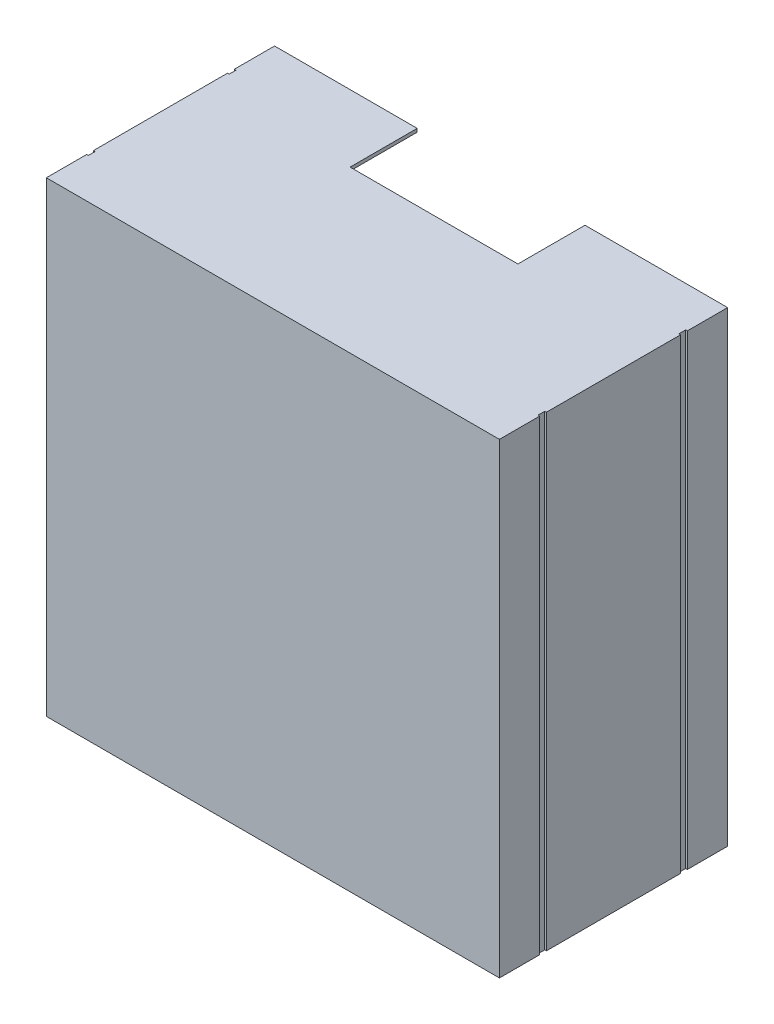
from build123d import *

# Parameters (mm, degrees)
SKETCH_1_W          = 270
SKETCH_1_H          = 136
EXTRUDE_1_DEPTH     = 278
SKETCH_2_W          = 266
SKETCH_2_H          = 274
CUT_EXTRUDE_1_DEPTH = 134
CUT_EXTRUDE_2_REACH = 318.438
SKETCH_3_W          = 100
SKETCH_3_H          = 40
CUT_EXTRUDE_3_REACH = 318.438
SKETCH_4_W          = 1
SKETCH_4_H          = 4


with BuildPart() as part:
    # 草图1 → 凸台-拉伸1 (new body)
    with BuildSketch(Plane(origin=(0, 0, 0), x_dir=(1, 0, 0), z_dir=(0, 1, 0))):
        Rectangle(SKETCH_1_W, SKETCH_1_H)
    extrude(amount=EXTRUDE_1_DEPTH)

    # 草图2 → 切除-拉伸1 (cut)
    with BuildSketch(Plane(origin=(0, 0, -68), x_dir=(-1, 0, 0), z_dir=(0, 0, -1))):
        with Locations((0, 139)):
            Rectangle(SKETCH_2_W, SKETCH_2_H)
    extrude(amount=-CUT_EXTRUDE_1_DEPTH, mode=Mode.SUBTRACT)

    # 草图3 → 切除-拉伸2 (cut, up to next)
    with BuildSketch(Plane(origin=(0, 278, 0), x_dir=(1, 0, 0), z_dir=(0, 1, 0)), mode=Mode.PRIVATE) as cut_extrude_2_sk1:
        with Locations((0, 48)):
            Rectangle(SKETCH_3_W, SKETCH_3_H)
    cut_extrude_2_tool1 = extrude(cut_extrude_2_sk1.sketch, amount=-CUT_EXTRUDE_2_REACH, mode=Mode.PRIVATE) & part.part
    add(cut_extrude_2_tool1.solids().sort_by_distance((0, 278, -48))[0], mode=Mode.SUBTRACT)

    # 草图4 → 切除-拉伸3 (cut, up to next)
    with BuildSketch(Plane.XZ, mode=Mode.PRIVATE) as cut_extrude_3_sk1:
        with Locations((-134.5, 42)):
            Rectangle(SKETCH_4_W, SKETCH_4_H)
    cut_extrude_3_tool1 = extrude(cut_extrude_3_sk1.sketch, amount=-CUT_EXTRUDE_3_REACH, mode=Mode.PRIVATE) & part.part
    # 草图4 → 切除-拉伸3 (cut, up to next)
    with BuildSketch(Plane.XZ, mode=Mode.PRIVATE) as cut_extrude_3_sk2:
        with Locations((-134.5, -42)):
            Rectangle(SKETCH_4_W, SKETCH_4_H)
    cut_extrude_3_tool2 = extrude(cut_extrude_3_sk2.sketch, amount=-CUT_EXTRUDE_3_REACH, mode=Mode.PRIVATE) & part.part
    # 草图4 → 切除-拉伸3 (cut, up to next)
    with BuildSketch(Plane.XZ, mode=Mode.PRIVATE) as cut_extrude_3_sk3:
        with Locations((134.5, -42)):
            Rectangle(SKETCH_4_W, SKETCH_4_H)
    cut_extrude_3_tool3 = extrude(cut_extrude_3_sk3.sketch, amount=-CUT_EXTRUDE_3_REACH, mode=Mode.PRIVATE) & part.part
    # 草图4 → 切除-拉伸3 (cut, up to next)
    with BuildSketch(Plane.XZ, mode=Mode.PRIVATE) as cut_extrude_3_sk4:
        with Locations((134.5, 42)):
            Rectangle(SKETCH_4_W, SKETCH_4_H)
    cut_extrude_3_tool4 = extrude(cut_extrude_3_sk4.sketch, amount=-CUT_EXTRUDE_3_REACH, mode=Mode.PRIVATE) & part.part
    add(cut_extrude_3_tool1.solids().sort_by_distance((-134.5, 0, 42))[0], mode=Mode.SUBTRACT)
    add(cut_extrude_3_tool2.solids().sort_by_distance((-134.5, 0, -42))[0], mode=Mode.SUBTRACT)
    add(cut_extrude_3_tool3.solids().sort_by_distance((134.5, 0, -42))[0], mode=Mode.SUBTRACT)
    add(cut_extrude_3_tool4.solids().sort_by_distance((134.5, 0, 42))[0], mode=Mode.SUBTRACT)


solid = part.part
